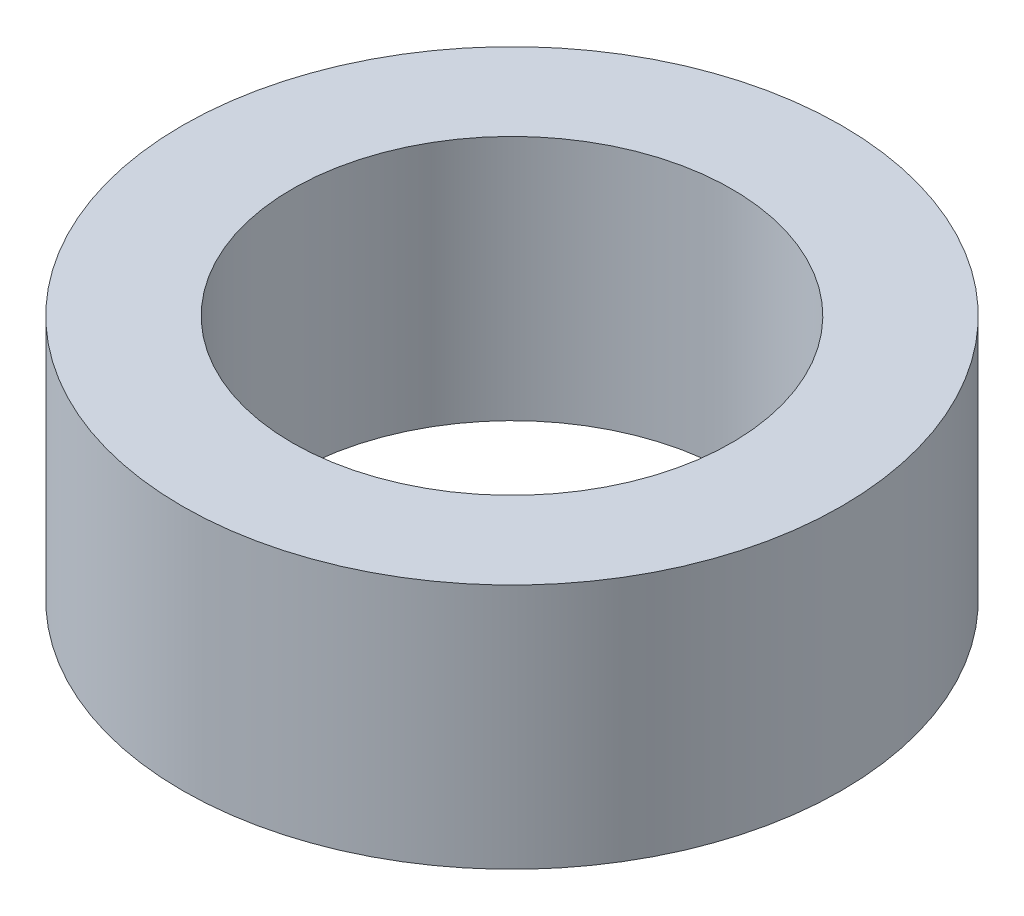
from build123d import *

# Parameters (mm, degrees)
SKETCH1_R           = 9.525
SKETCH1_R_2         = 6.35
BOSS_EXTRUDE1_DEPTH = 7.112


with BuildPart() as part:
    # Sketch1 → Boss-Extrude1 (new body)
    with BuildSketch(Plane(origin=(0, 0, 0), x_dir=(1, 0, 0), z_dir=(0, 1, 0))):
        with Locations(Location((0, 0, 0), (0, 0, 270))):
            Circle(SKETCH1_R)
        with Locations(Location((0, 0, 0), (0, 0, 270))):
            Circle(SKETCH1_R_2, mode=Mode.SUBTRACT)
    extrude(amount=BOSS_EXTRUDE1_DEPTH)


solid = part.part
